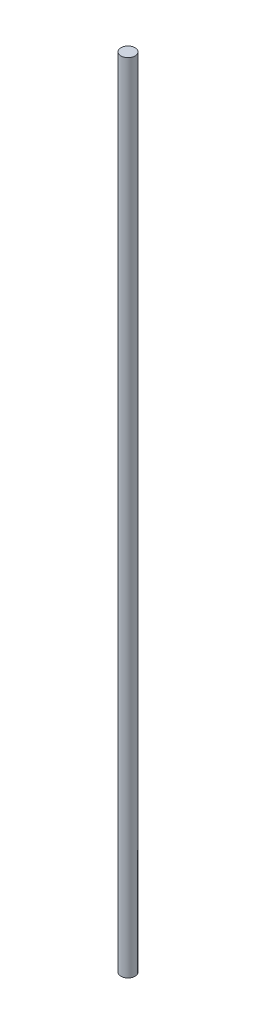
from build123d import *

# Parameters (mm, degrees)
SKETCH1_R           = 3.175
BOSS_EXTRUDE1_DEPTH = 355.6


with BuildPart() as part:
    # Sketch1 → Boss-Extrude1 (new body)
    with BuildSketch(Plane(origin=(0, 0, 0), x_dir=(1, 0, 0), z_dir=(0, 1, 0))):
        with Locations(Location((0, 0, 0), (0, 0, 270))):
            Circle(SKETCH1_R)
    extrude(amount=BOSS_EXTRUDE1_DEPTH)


solid = part.part
